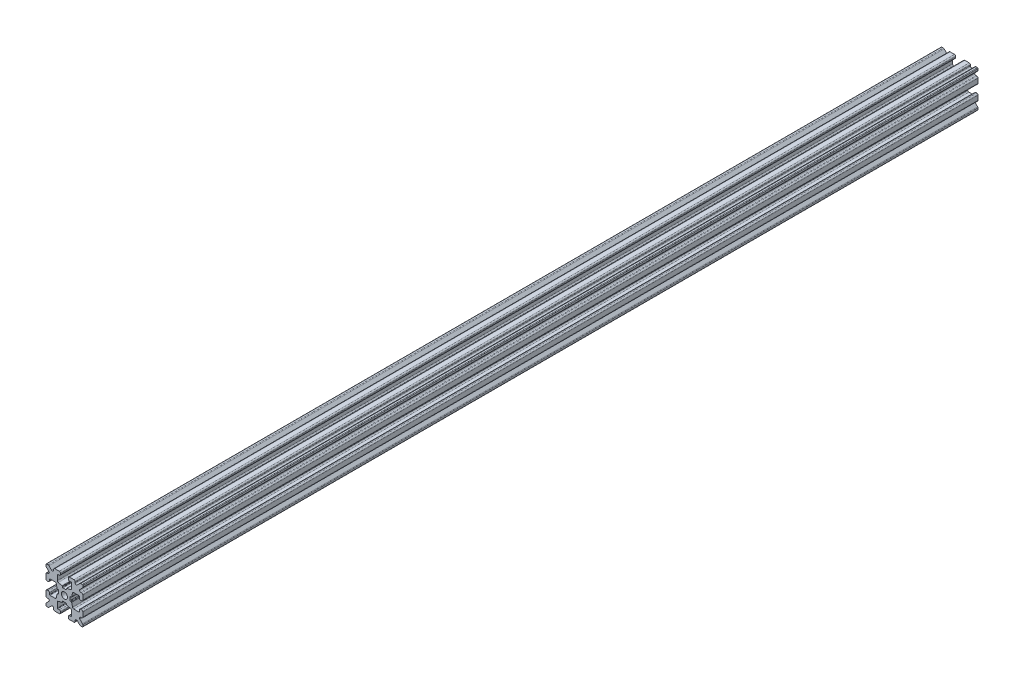
from build123d import *

# Parameters (mm, degrees)
SKETCH1_W           = 15
SKETCH1_H           = 15
SKETCH1_R           = 1.25
BOSS_EXTRUDE1_DEPTH = 182.5
FILLET1_R           = 0.25
CUT_EXTRUDE1_DEPTH  = 366.154077069
CUT_EXTRUDE3_DEPTH  = 366.154077069
FILLET3_R           = 0.5
FILLET4_R           = 0.5
FILLET5_R           = 3
FILLET6_R           = 0.2
CUT_EXTRUDE4_DEPTH  = 366.154077069
FILLET8_R           = 0.5
SKETCH6_W           = 5.1529354
SKETCH6_H           = 1.651
SKETCH6_W_2         = 1.651
SKETCH6_H_2         = 5.1529354
CUT_EXTRUDE5_DEPTH  = 366.154077069
FILLET10_R          = 0.2


with BuildPart() as part:
    # Sketch1 → Boss-Extrude1 (new, symmetric)
    with BuildSketch(Plane.XY):
        Rectangle(SKETCH1_W, SKETCH1_H)
        Circle(SKETCH1_R, mode=Mode.SUBTRACT)
    extrude(amount=BOSS_EXTRUDE1_DEPTH, both=True)

    # Fillet1
    fillet1_edges = [part.edges().sort_by_distance(p)[0] for p in [
        (7.5, -7.5, 0),
        (-7.5, -7.5, 0),
        (-7.5, 7.5, 0),
        (7.5, 7.5, 0),
    ]]
    fillet(fillet1_edges, radius=FILLET1_R)

    # Sketch2 → Cut-Extrude1 (cut, through all)
    with BuildSketch(Plane.XY.offset(182.5)):
        Polygon((-7.5, 1.6), (-6.1, 1.6), (-6.1, 2.9), (-3.4, 2.9), (-3.4, -2.9), (-6.1, -2.9), (-6.1, -1.6), (-7.5, -1.6), align=None)
        Polygon((2.9, 6.1), (1.6, 6.1), (1.6, 7.5), (-1.6, 7.5), (-1.6, 6.1), (-2.9, 6.1), (-2.9, 3.4), (2.9, 3.4), align=None)
        Polygon((-1.6, -7.5), (-1.6, -6.1), (-2.9, -6.1), (-2.9, -3.4), (2.9, -3.4), (2.9, -6.1), (1.6, -6.1), (1.6, -7.5), align=None)
        Polygon((6.1, -2.9), (6.1, -1.6), (7.5, -1.6), (7.5, 1.6), (6.1, 1.6), (6.1, 2.9), (3.4, 2.9), (3.4, -2.9), align=None)
    extrude(amount=-CUT_EXTRUDE1_DEPTH, mode=Mode.SUBTRACT)

    # Sketch4 → Cut-Extrude3 (cut, through all)
    with BuildSketch(Plane.XY.offset(182.5)):
        Polygon((-3.4, 2.9), (-2.75, 0), (-3.4, -2.9), align=None)
        Polygon((-2.9, 3.4), (0, 2.75), (2.9, 3.4), align=None)
        Polygon((3.4, 2.9), (2.75, 0), (3.4, -2.9), align=None)
        Polygon((-2.9, -3.4), (0, -2.75), (2.9, -3.4), align=None)
    extrude(amount=-CUT_EXTRUDE3_DEPTH, mode=Mode.SUBTRACT)

    # Fillet3
    fillet3_edges = [part.edges().sort_by_distance(p)[0] for p in [
        (1.6, -7.5, 0),
        (-1.6, -7.5, 0),
        (-1.6, -6.1, 0),
        (1.6, -6.1, 0),
        (6.1, 1.6, 0),
        (7.5, 1.6, 0),
        (7.5, -1.6, 0),
        (6.1, -1.6, 0),
        (-7.5, -1.6, 0),
        (-7.5, 1.6, 0),
        (-6.1, 1.6, 0),
        (-6.1, -1.6, 0),
        (-1.6, 6.1, 0),
        (-1.6, 7.5, 0),
        (1.6, 7.5, 0),
        (1.6, 6.1, 0),
    ]]
    fillet(fillet3_edges, radius=FILLET3_R)

    # Fillet4
    fillet4_edges = [part.edges().sort_by_distance(p)[0] for p in [
        (-2.9, -3.4, 0),
        (2.9, -3.4, 0),
        (3.4, -2.9, 0),
        (3.4, 2.9, 0),
        (-3.4, 2.9, 0),
        (-3.4, -2.9, 0),
        (2.9, 3.4, 0),
        (-2.9, 3.4, 0),
    ]]
    fillet(fillet4_edges, radius=FILLET4_R)

    # Fillet5
    fillet5_edges = [part.edges().sort_by_distance(p)[0] for p in [
        (-2.75, 0, 0),
        (0, 2.75, 0),
        (2.75, 0, 0),
        (0, -2.75, 0),
    ]]
    fillet(fillet5_edges, radius=FILLET5_R)

    # Fillet6
    fillet6_edges = [part.edges().sort_by_distance(p)[0] for p in [
        (-2.9, -6.1, 0),
        (2.9, -6.1, 0),
        (6.1, -2.9, 0),
        (6.1, 2.9, 0),
        (-6.1, 2.9, 0),
        (-6.1, -2.9, 0),
        (2.9, 6.1, 0),
        (-2.9, 6.1, 0),
    ]]
    fillet(fillet6_edges, radius=FILLET6_R)

    # Sketch5 → Cut-Extrude4 (cut, through all)
    with BuildSketch(Plane.XY.offset(182.5)):
        Polygon((-7.5, 6.439339828), (-5.460660172, 4.4), (-7.5, 4.4), align=None)
        Polygon((-6.439339828, 7.5), (-4.4, 5.460660172), (-4.4, 7.5), align=None)
        Polygon((4.4, 7.5), (6.439339828, 7.5), (4.4, 5.460660172), align=None)
        Polygon((7.5, 6.439339828), (7.5, 4.4), (5.460660172, 4.4), align=None)
        Polygon((7.5, -6.439339828), (5.460660172, -4.4), (7.5, -4.4), align=None)
        Polygon((6.439339828, -7.5), (4.4, -5.460660172), (4.4, -7.5), align=None)
        Polygon((-4.4, -7.5), (-6.439339828, -7.5), (-4.4, -5.460660172), align=None)
        Polygon((-7.5, -6.439339828), (-7.5, -4.4), (-5.460660172, -4.4), align=None)
    extrude(amount=-CUT_EXTRUDE4_DEPTH, mode=Mode.SUBTRACT)

    # Fillet8
    fillet8_edges = [part.edges().sort_by_distance(p)[0] for p in [
        (-7.5, 4.4, 0),
        (-7.5, 6.439339828, 0),
        (-5.460660172, 4.4, 0),
        (7.5, -4.4, 0),
        (7.5, -6.439339828, 0),
        (5.460660172, -4.4, 0),
        (5.460660172, 4.4, 0),
        (7.5, 6.439339828, 0),
        (7.5, 4.4, 0),
        (-4.4, 7.5, 0),
        (-4.4, 5.460660172, 0),
        (-6.439339828, 7.5, 0),
        (-5.460660172, -4.4, 0),
        (-7.5, -6.439339828, 0),
        (-7.5, -4.4, 0),
        (4.4, 5.460660172, 0),
        (4.4, 7.5, 0),
        (6.439339828, 7.5, 0),
        (6.439339828, -7.5, 0),
        (4.4, -7.5, 0),
        (4.4, -5.460660172, 0),
        (-6.439339828, -7.5, 0),
        (-4.4, -5.460660172, 0),
        (-4.4, -7.5, 0),
    ]]
    fillet(fillet8_edges, radius=FILLET8_R)

    # Sketch6 → Cut-Extrude5 (cut, through all)
    with BuildSketch(Plane.XY.offset(182.5)):
        with Locations((4.9235323, 0)):
            Rectangle(SKETCH6_W, SKETCH6_H)
        with Locations((0, -4.9235323)):
            Rectangle(SKETCH6_W_2, SKETCH6_H_2)
        with Locations((-4.9235323, 0)):
            Rectangle(SKETCH6_W, SKETCH6_H)
        with Locations((0, 4.9235323)):
            Rectangle(SKETCH6_W_2, SKETCH6_H_2)
    extrude(amount=-CUT_EXTRUDE5_DEPTH, mode=Mode.SUBTRACT)

    # Fillet10
    fillet10_edges = [part.edges().sort_by_distance(p)[0] for p in [
        (0.8255, -2.935025862, 0),
        (-0.8255, -2.935025862, 0),
        (0.8255, -2.3470646, 0),
        (-0.8255, -2.3470646, 0),
        (2.935025862, 0.8255, 0),
        (2.935025862, -0.8255, 0),
        (2.3470646, 0.8255, 0),
        (2.3470646, -0.8255, 0),
        (-2.935025862, -0.8255, 0),
        (-2.935025862, 0.8255, 0),
        (-2.3470646, -0.8255, 0),
        (-2.3470646, 0.8255, 0),
        (-0.8255, 2.935025862, 0),
        (0.8255, 2.935025862, 0),
        (-0.8255, 2.3470646, 0),
        (0.8255, 2.3470646, 0),
    ]]
    fillet(fillet10_edges, radius=FILLET10_R)


solid = part.part
